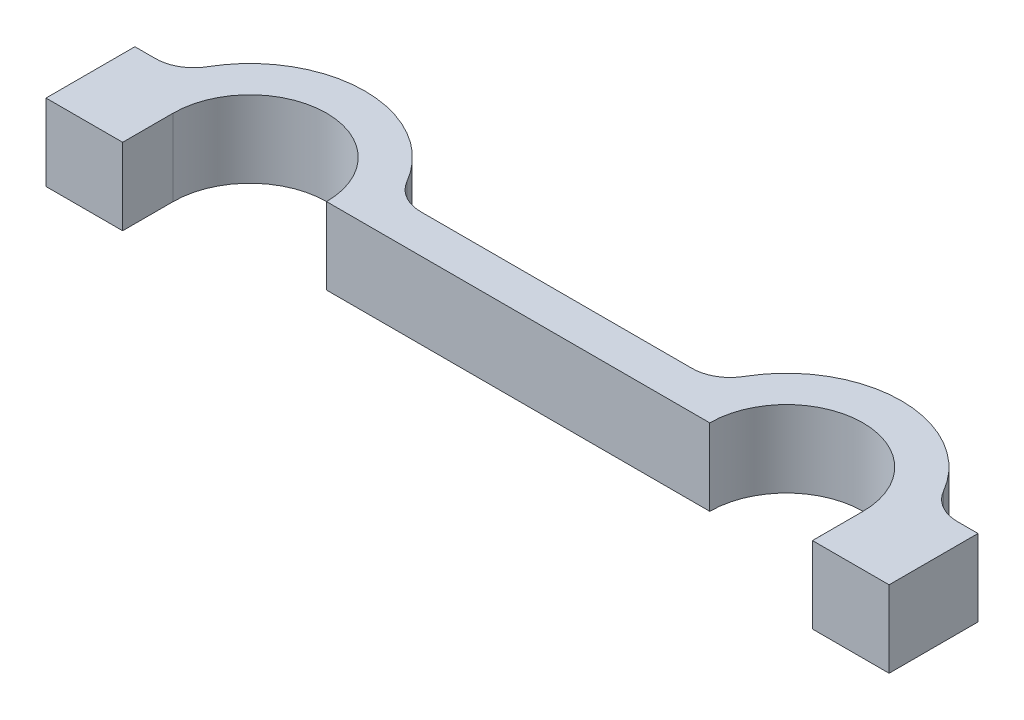
from build123d import *

# Parameters (mm, degrees)
BOSS_EXTRUDE1_DEPTH = 12.7
SKETCH2_W           = 12.7
SKETCH2_H           = 12.7
BOSS_EXTRUDE2_DEPTH = 8.382


with BuildPart() as part:
    # Sketch1 → Boss-Extrude1 (new body)
    with BuildSketch(Plane(origin=(0, 0, 0), x_dir=(1, 0, 0), z_dir=(0, 1, 0))):
        with BuildLine():
            Line((25.4, 0), (88.9, 0))
            ThreePointArc((88.9, 0), (101.6, 12.7), (114.3, 0))
            Line((114.3, 0), (127, 0))
            Line((127, 0), (127, 6.35))
            Line((127, 6.35), (123.597045256, 6.35))
            ThreePointArc((123.597045256, 6.35), (120.422045256, 7.200738686), (118.097783942, 9.525))
            ThreePointArc((118.097783942, 9.525), (101.6, 19.05), (85.102216058, 9.525))
            ThreePointArc((85.102216058, 9.525), (82.777954744, 7.200738686), (79.602954744, 6.35))
            Line((79.602954744, 6.35), (34.697045256, 6.35))
            ThreePointArc((34.697045256, 6.35), (31.522045256, 7.200738686), (29.197783942, 9.525))
            ThreePointArc((29.197783942, 9.525), (12.7, 19.05), (-3.797783942, 9.525))
            ThreePointArc((-3.797783942, 9.525), (-6.122045256, 7.200738686), (-9.297045256, 6.35))
            Line((-9.297045256, 6.35), (-12.7, 6.35))
            Line((-12.7, 6.35), (-12.7, 0))
            Line((-12.7, 0), (0, 0))
            ThreePointArc((0, 0), (12.7, 12.7), (25.4, 0))
        make_face()
    extrude(amount=BOSS_EXTRUDE1_DEPTH)

    # Sketch2 → Boss-Extrude2 (add)
    with BuildSketch(Plane.XY):
        with Locations((-6.35, 6.35)):
            Rectangle(SKETCH2_W, SKETCH2_H)
        with Locations((120.65, 6.35)):
            Rectangle(SKETCH2_W, SKETCH2_H)
    extrude(amount=BOSS_EXTRUDE2_DEPTH)


solid = part.part
